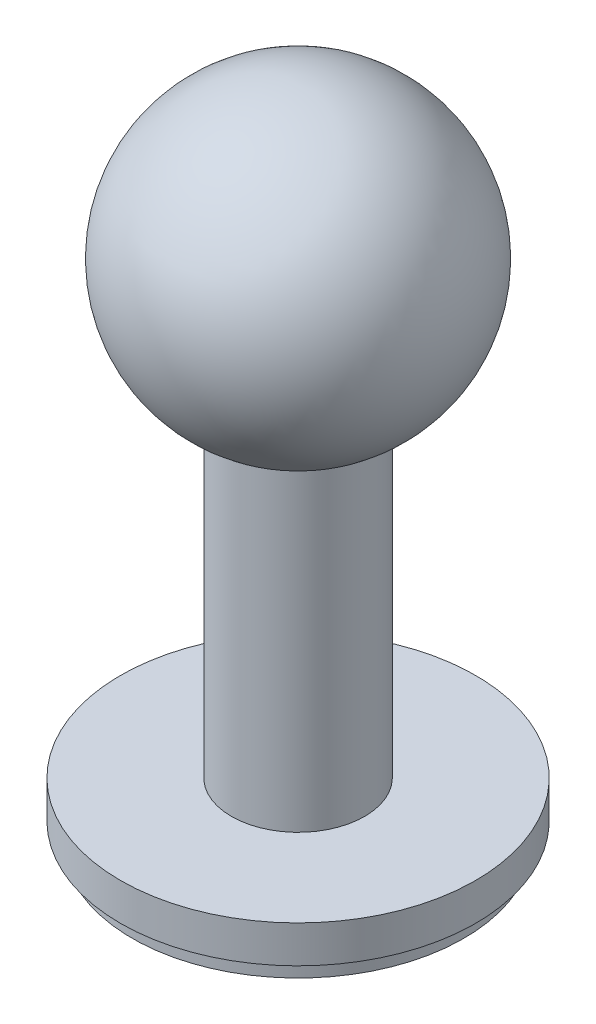
from build123d import *

# Parameters (mm, degrees)
SKETCH1_R           = 7.5
BOSS_EXTRUDE1_DEPTH = 1.57
SKETCH2_R           = 2.815
BOSS_EXTRUDE2_DEPTH = 19
SKETCH4_R           = 7
BOSS_EXTRUDE3_DEPTH = 0.8


with BuildPart() as part:
    # Sketch1 → Boss-Extrude1 (new body)
    with BuildSketch(Plane(origin=(0, 0, 0), x_dir=(1, 0, 0), z_dir=(0, 1, 0))):
        with Locations(Location((0, 0, 0), (0, 0, 270))):
            Circle(SKETCH1_R)
    extrude(amount=BOSS_EXTRUDE1_DEPTH)

    # Sketch2 → Boss-Extrude2 (add)
    with BuildSketch(Plane(origin=(0, 1.57, 0), x_dir=(1, 0, 0), z_dir=(0, 1, 0))):
        with Locations(Location((0, 0, 0), (0, 0, 270))):
            Circle(SKETCH2_R)
    extrude(amount=BOSS_EXTRUDE2_DEPTH)

    # Sketch3 → Revolve1 (revolve)
    with BuildSketch(Plane(origin=(0, 20.57, 0), x_dir=(1, 0, 0), z_dir=(0, 1, 0))):
        with BuildLine():
            Line((0, 6.35), (0, -6.35))
            ThreePointArc((0, -6.35), (6.35, 0), (0, 6.35))
        make_face()
    revolve(axis=Axis((0, 20.57, -8.311953328), (0, 0, 1)))

    # Sketch4 → Boss-Extrude3 (add)
    with BuildSketch(Plane.XZ):
        with Locations(Location((0, 0, 0), (0, 0, 270))):
            Circle(SKETCH4_R)
    extrude(amount=BOSS_EXTRUDE3_DEPTH)


solid = part.part
